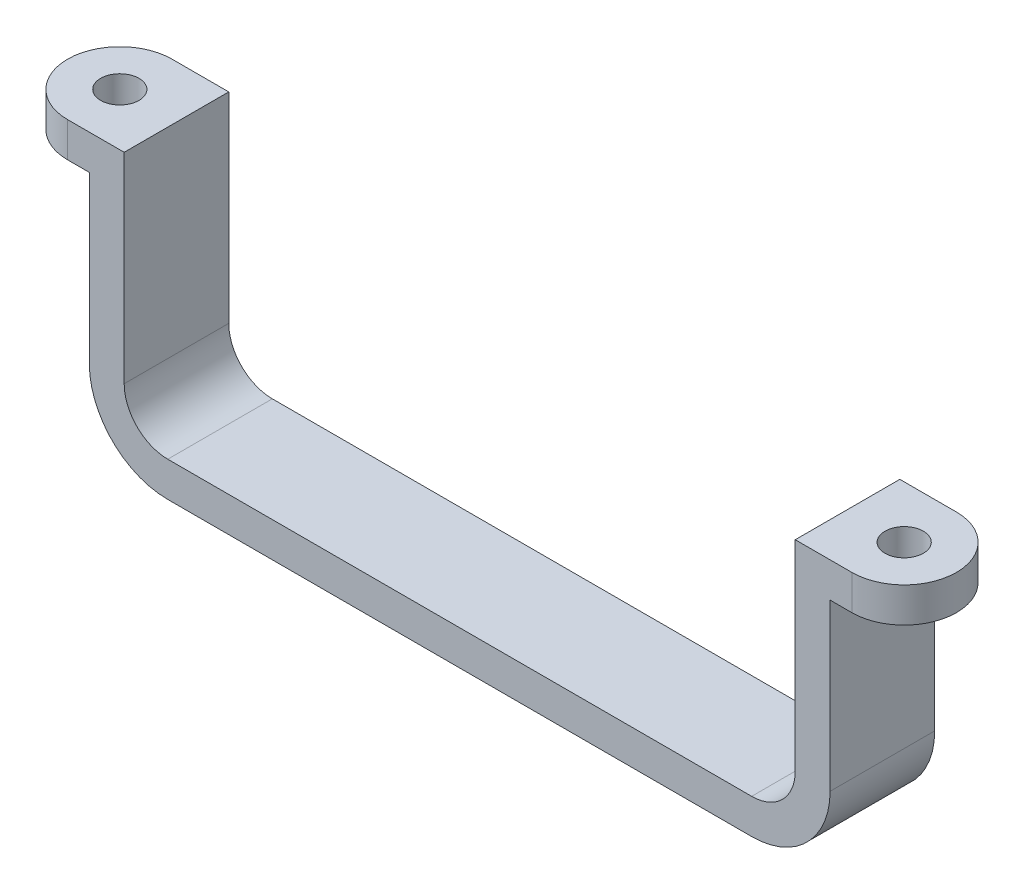
from build123d import *

# Parameters (mm, degrees)
BOSS_EXTRUDE1_DEPTH = 6
SKETCH3_R           = 1.1
BOSS_EXTRUDE6_DEPTH = 2


with BuildPart() as part:
    # Sketch1 → Boss-Extrude1 (new body)
    with BuildSketch(Plane.XY):
        with BuildLine():
            Line((-21.25, 14), (-21.25, 2.5))
            ThreePointArc((-21.25, 2.5), (-19.931980515, -0.681980515), (-16.75, -2))
            Line((-16.75, -2), (16.75, -2))
            ThreePointArc((16.75, -2), (19.931980515, -0.681980515), (21.25, 2.5))
            Line((21.25, 2.5), (21.25, 14))
            Line((21.25, 14), (19.25, 14))
            Line((19.25, 14), (19.25, 2.5))
            ThreePointArc((19.25, 2.5), (18.517766953, 0.732233047), (16.75, 0))
            Line((16.75, 0), (-16.75, 0))
            ThreePointArc((-16.75, 0), (-18.517766953, 0.732233047), (-19.25, 2.5))
            Line((-19.25, 2.5), (-19.25, 14))
            Line((-19.25, 14), (-21.25, 14))
        make_face()
    extrude(amount=BOSS_EXTRUDE1_DEPTH)

    # Sketch3 → Boss-Extrude6 (add)
    # profile 1 of 2: a face of its own
    with BuildSketch(Plane(origin=(0, 14, 0), x_dir=(-1, 0, 0), z_dir=(0, 1, 0))):
        with BuildLine():
            Line((-21.25, 6), (-22.5, 6))
            ThreePointArc((-22.5, 6), (-25.5, 3), (-22.5, 0))
            Line((-22.5, 0), (-21.25, 0))
            Line((-21.25, 0), (-21.25, 6))
        make_face()
        with Locations(Location((-22.5, 3, 0), (0, 0, 90))):
            Circle(SKETCH3_R, mode=Mode.SUBTRACT)
    # profile 2 of 2: a face of its own
    with BuildSketch(Plane(origin=(0, 14, 0), x_dir=(-1, 0, 0), z_dir=(0, 1, 0))):
        with BuildLine():
            Line((22.5, 6), (21.25, 6))
            Line((21.25, 6), (21.25, 0))
            Line((21.25, 0), (22.5, 0))
            ThreePointArc((22.5, 0), (25.5, 3), (22.5, 6))
        make_face()
        with Locations(Location((22.5, 3, 0), (0, 0, 90))):
            Circle(SKETCH3_R, mode=Mode.SUBTRACT)
    extrude(amount=-BOSS_EXTRUDE6_DEPTH)


solid = part.part
